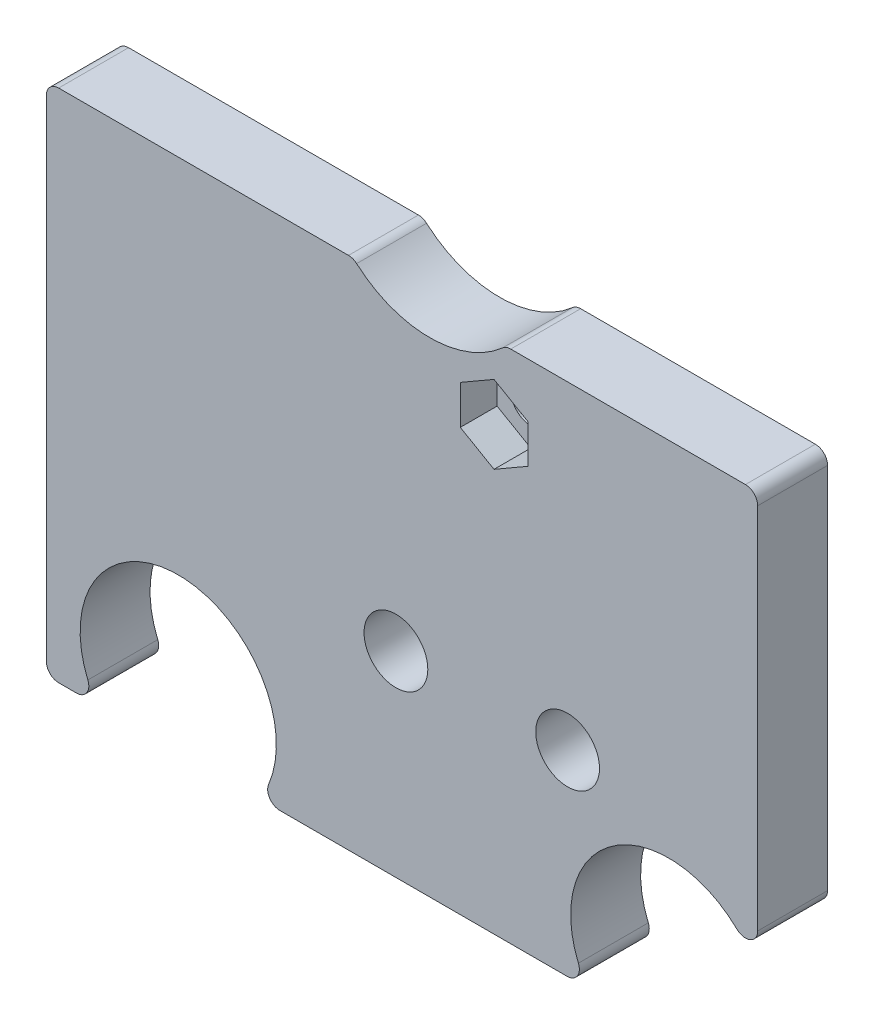
from build123d import *

# Parameters (mm, degrees)
SKIZZE2_W                       = 58
SKIZZE2_H                       = 42
AUFSATZ_LINEAR_AUSTRAGEN1_DEPTH = 5.7
SKIZZE1_R                       = 9
SKIZZE1_R_2                     = 8
SKIZZE1_R_3                     = 2.6
SCHNITT_LINEAR_AUSTRAGEN2_DEPTH = 58.976741026
SCHNITT_LINEAR_AUSTRAGEN3_DEPTH = 58.976741026
VERRUNDUNG1_R                   = 1
SCHNITT_LINEAR_AUSTRAGEN4_DEPTH = 3
SKIZZE5_R                       = 1.6
SCHNITT_LINEAR_AUSTRAGEN5_DEPTH = 58.773804618


with BuildPart() as part:
    # Skizze2 → Aufsatz-Linear austragen1 (new body)
    with BuildSketch(Plane.XY):
        with Locations((-2.25, -27.5)):
            Rectangle(SKIZZE2_W, SKIZZE2_H)
    extrude(amount=AUFSATZ_LINEAR_AUSTRAGEN1_DEPTH)

    # Skizze1 → Schnitt-Linear austragen2 (cut, through all)
    with BuildSketch(Plane.XY):
        Circle(SKIZZE1_R)
        with Locations((-20.5, -44)):
            Circle(SKIZZE1_R_2)
        with Locations((19.5, -44)):
            Circle(SKIZZE1_R_2)
        with Locations((11.25, -32.5)):
            Circle(SKIZZE1_R_3)
        with Locations((-2.75, -32.5)):
            Circle(SKIZZE1_R_3)
    extrude(amount=SCHNITT_LINEAR_AUSTRAGEN2_DEPTH, mode=Mode.SUBTRACT)


with BuildPart() as schnitt_linear_austragen2_piece_1:
    # of the separate pieces the step leaves, piece 1, a body of its own (schnitt_linear_austragen2_pieces)
    add(part.part.solids().sort_by_distance((-31.25, -6.5, 0))[0])

    # Verrundung1
    verrundung1_edges = [schnitt_linear_austragen2_piece_1.edges().sort_by_distance(p)[0] for p in [
        (26.75, -6.5, 2.85),
        (-31.25, -48.5, 2.85),
        (-31.25, -6.5, 2.85),
        (-13.885621722, -48.5, 2.85),
        (-27.114378278, -48.5, 2.85),
        (26.75, -40.618062685, 2.85),
        (12.885621722, -48.5, 2.85),
        (-6.224949799, -6.5, 2.85),
        (6.224949799, -6.5, 2.85),
    ]]
    fillet(verrundung1_edges, radius=VERRUNDUNG1_R)

    # Skizze4 → Schnitt-Linear austragen4 (cut)
    with BuildSketch(Plane.XY.offset(5.7)):
        Polygon((2.5, -14.08771324), (5.25, -15.675426481), (8, -14.08771324), (8, -10.91228676), (5.25, -9.324573519), (2.5, -10.91228676), align=None)
    extrude(amount=-SCHNITT_LINEAR_AUSTRAGEN4_DEPTH, mode=Mode.SUBTRACT)

    # Skizze5 → Schnitt-Linear austragen5 (cut, through all)
    with BuildSketch(Plane.XY.offset(2.7)):
        with Locations((5.25, -12.5)):
            Circle(SKIZZE5_R)
    extrude(amount=-SCHNITT_LINEAR_AUSTRAGEN5_DEPTH, mode=Mode.SUBTRACT)


with BuildPart() as schnitt_linear_austragen2_piece_2:
    # of the separate pieces the step leaves, piece 2, a body of its own (schnitt_linear_austragen2_pieces)
    add(part.part.solids().sort_by_distance((26.114378278, -48.5, 0))[0])

    # Skizze3 → Schnitt-Linear austragen3 (cut, through all)
    with BuildSketch(Plane.XY.offset(5.7)):
        with BuildLine():
            Line((26.75, -48.5), (26.75, -47.381937315))
            ThreePointArc((26.75, -47.381937315), (26.454693545, -47.953762474), (26.114378278, -48.5))
            Line((26.114378278, -48.5), (26.75, -48.5))
        make_face()
    extrude(amount=-SCHNITT_LINEAR_AUSTRAGEN3_DEPTH, mode=Mode.SUBTRACT)


solid = schnitt_linear_austragen2_piece_1.part
